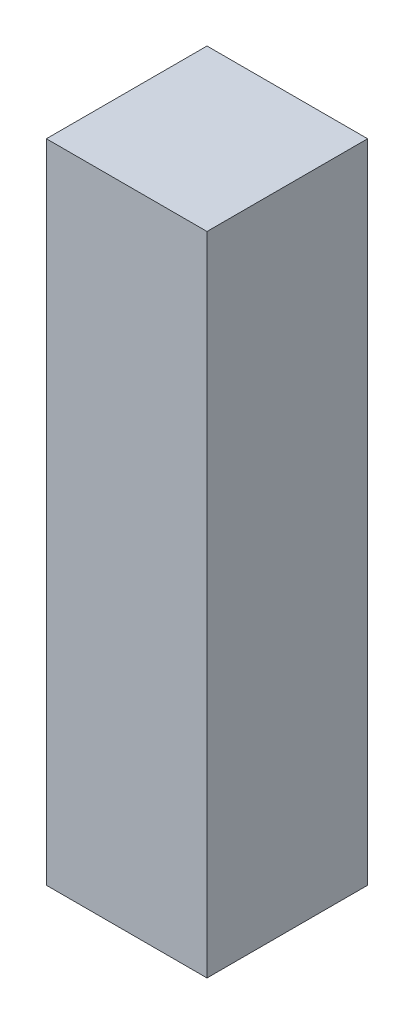
from build123d import *

# Parameters (mm, degrees)
SKETCH_1_W      = 20
SKETCH_1_H      = 20
EXTRUDE_1_DEPTH = 80.5


with BuildPart() as part:
    # 草图1 → 凸台-拉伸1 (new body)
    with BuildSketch(Plane(origin=(0, 0, 0), x_dir=(1, 0, 0), z_dir=(0, 1, 0))):
        Rectangle(SKETCH_1_W, SKETCH_1_H)
    extrude(amount=EXTRUDE_1_DEPTH)


solid = part.part
